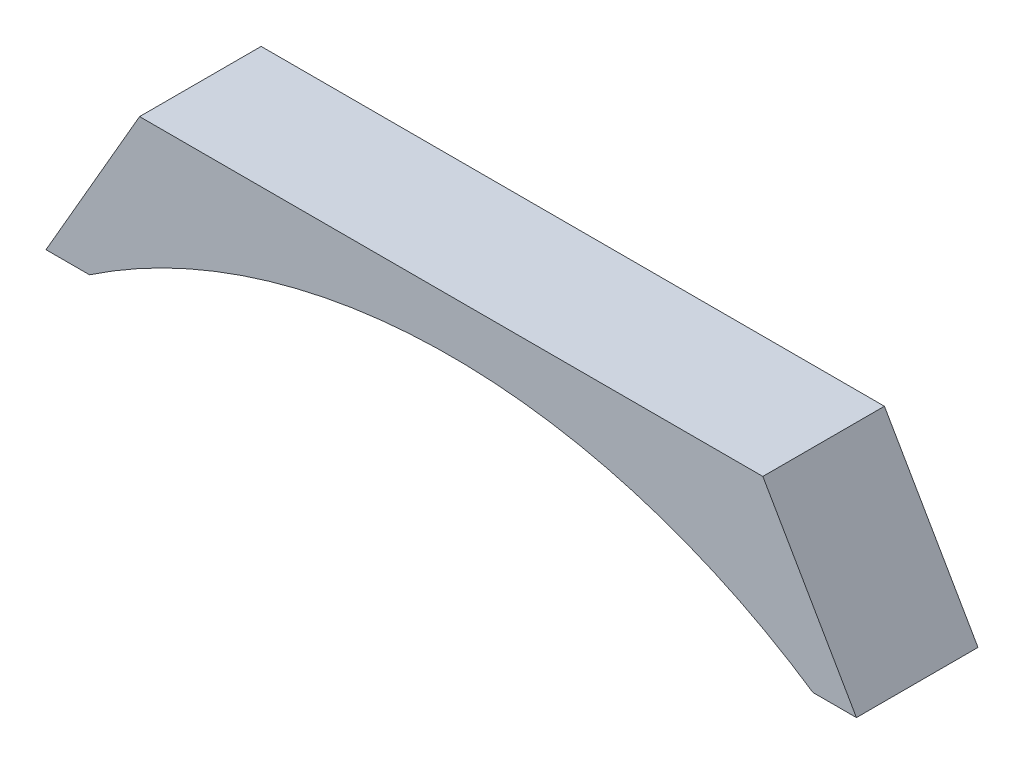
from build123d import *

# Parameters (mm, degrees)
BOSS_EXTRUDE1_DEPTH = 19.05
SKETCH2_W           = 119.77527386
SKETCH2_H           = 145.609156457
CUT_EXTRUDE1_DEPTH  = 25.4
SKETCH3_R           = 101.6
CUT_EXTRUDE2_DEPTH  = 85.36695047


with BuildPart() as part:
    # Sketch1 → Boss-Extrude1 (new body)
    with BuildSketch(Plane.XY):
        Polygon((-78.164696837, 0), (-63.5, 25.4), (63.5, 25.4), (78.164696837, 0), align=None)
    extrude(amount=-BOSS_EXTRUDE1_DEPTH)

    # Sketch2 → Cut-Extrude1 (cut)
    with BuildSketch(Plane(origin=(58.623522628, 33.84630657, 0), x_dir=(0, 0, -1), z_dir=(0.866025403784436, 0.5000000000000047, 0))):
        with Locations((20.492508396, -22.352934086)):
            Rectangle(SKETCH2_W, SKETCH2_H)
    extrude(amount=-CUT_EXTRUDE1_DEPTH, mode=Mode.SUBTRACT)

    # Sketch3 → Cut-Extrude2 (cut, through all)
    with BuildSketch(Plane.XY):
        with Locations((-14.664696837, -84.31457873)):
            Circle(SKETCH3_R)
    extrude(amount=-CUT_EXTRUDE2_DEPTH, mode=Mode.SUBTRACT)


solid = part.part
